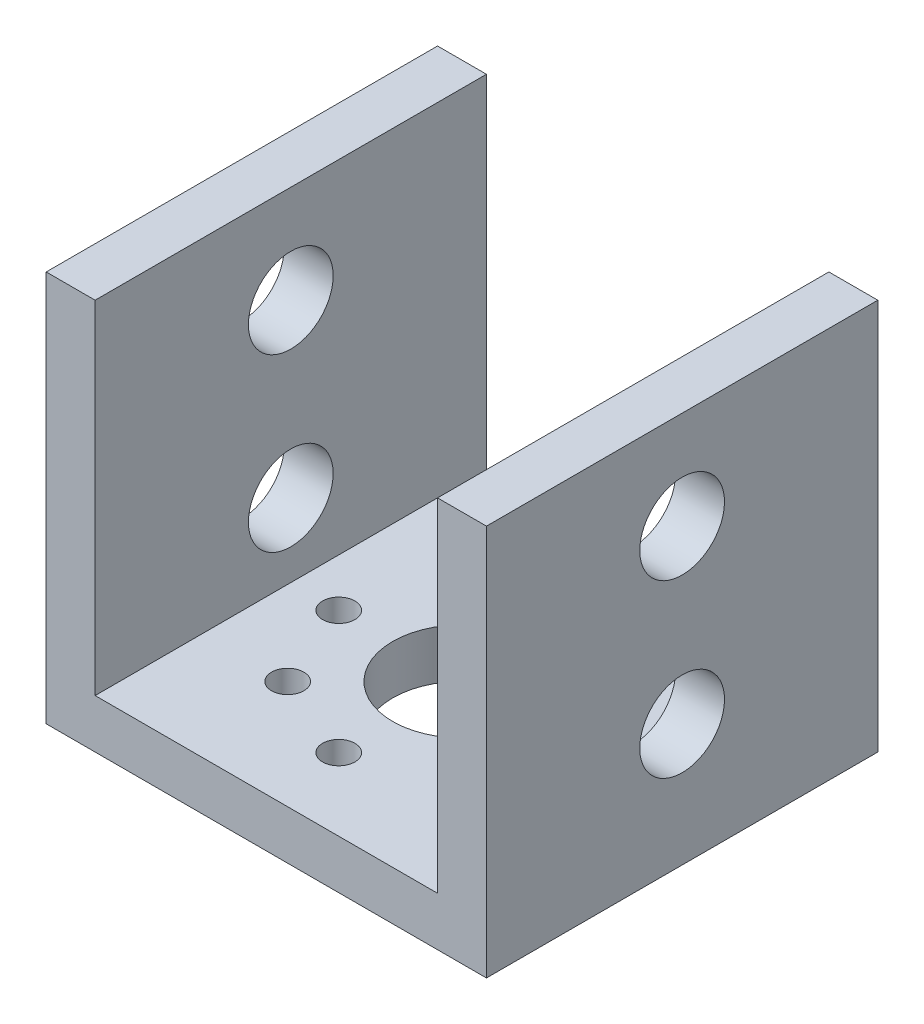
from build123d import *

# Parameters (mm, degrees)
BOSS_EXTRUDE1_DEPTH   = 25.4
SKETCH2_R             = 2.75
CUT_EXTRUDE1_DEPTH    = 45.22263278
SKETCH3_R             = 4.500000017
CUT_EXTRUDE2_DEPTH    = 37.650283508
F_2_0MM_DOWEL_HOLE1_D = 2.1


with BuildPart() as part:
    # Sketch1 → Boss-Extrude1 (new body)
    with BuildSketch(Plane.XY):
        Polygon((-11.1125, 0), (11.1125, 0), (11.1125, 22.225), (14.2875, 22.225), (14.2875, -3.175), (-14.2875, -3.175), (-14.2875, 22.225), (-11.1125, 22.225), align=None)
    extrude(amount=BOSS_EXTRUDE1_DEPTH)

    # Sketch2 → Cut-Extrude1 (cut, through all)
    with BuildSketch(Plane(origin=(14.2875, 0, 0), x_dir=(0, 0, -1), z_dir=(1, 0, 0))):
        with Locations(Location((-12.7, 15.875, 0), (0, 0, 90))):
            Circle(SKETCH2_R)
        with Locations(Location((-12.7, 4.7625, 0), (0, 0, 90))):
            Circle(SKETCH2_R)
    extrude(amount=-CUT_EXTRUDE1_DEPTH, mode=Mode.SUBTRACT)

    # Sketch3 → Cut-Extrude2 (cut, through all)
    with BuildSketch(Plane(origin=(0, 0, 0), x_dir=(1, 0, 0), z_dir=(0, 1, 0))):
        with Locations(Location((0, -12.7, 0), (0, 0, 180))):
            Circle(SKETCH3_R)
    extrude(amount=-CUT_EXTRUDE2_DEPTH, mode=Mode.SUBTRACT)

    # Ø2.0mm Dowel Hole1 (through all)
    with Locations(Plane(origin=(0, 0, 0), x_dir=(1, 0, 0), z_dir=(0, 1, 0))):
        with Locations((0, -4.699999998), (5.656854251, -7.043145749), (8.000000002, -12.7), (5.656854251, -18.356854251), (0, -20.700000002), (-5.656854251, -18.356854251), (-8.000000002, -12.7), (-5.656854251, -7.043145749)):
            Hole(F_2_0MM_DOWEL_HOLE1_D / 2)


solid = part.part
